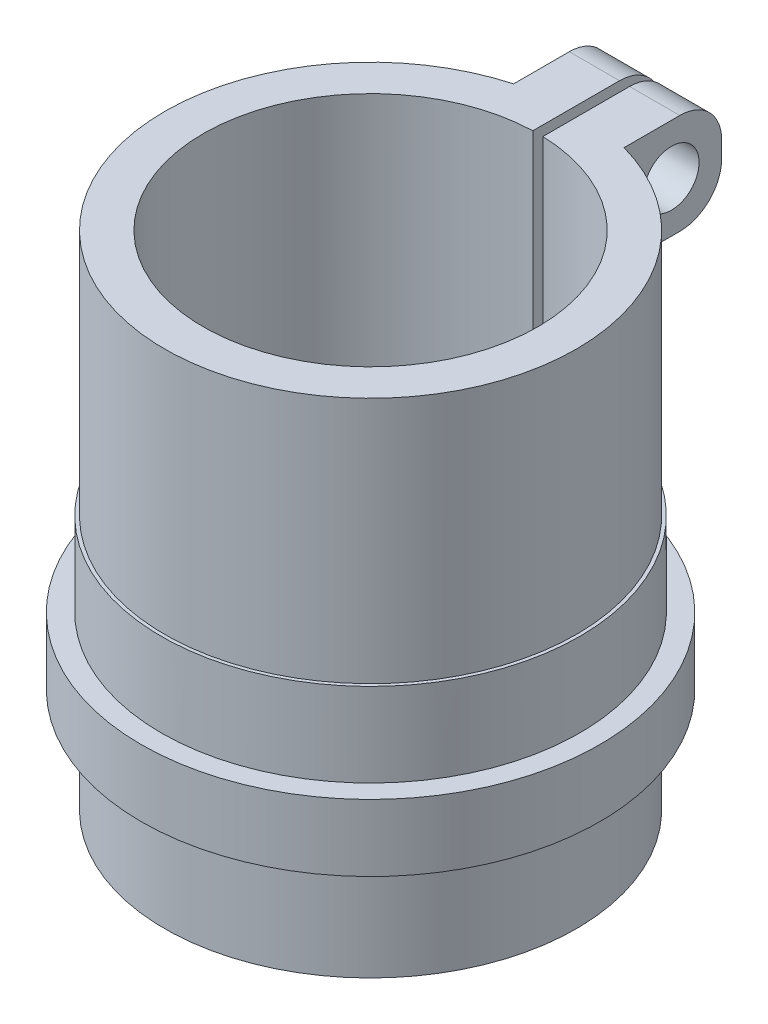
from build123d import *

# Parameters (mm, degrees)
SKETCH1_R           = 15.875
SKETCH1_R_2         = 12.7
BOSS_EXTRUDE1_DEPTH = 38.1
SKETCH2_R           = 17.399
SKETCH2_R_2         = 15.875
BOSS_EXTRUDE2_DEPTH = 5.0673
SKETCH3_R           = 15.875
SKETCH3_R_2         = 15.621
CUT_EXTRUDE1_DEPTH  = 7.9248
CUT_EXTRUDE2_START  = -19.3421
SKETCH3_2_R         = 15.875
SKETCH3_2_R_2       = 15.621
CUT_EXTRUDE2_DEPTH  = 18.7579
SKETCH4_W           = 0.762
SKETCH4_H           = 4.704716286
CUT_EXTRUDE3_DEPTH  = 19.05
SKETCH5_W           = 9.757521138
SKETCH5_H           = 7.62
SKETCH5_R           = 2.1
BOSS_EXTRUDE3_DEPTH = 3.81
FILLET1_R           = 3.175


with BuildPart() as part:
    # Sketch1 → Boss-Extrude1 (new body)
    with BuildSketch(Plane(origin=(0, 0, 0), x_dir=(1, 0, 0), z_dir=(0, 1, 0))):
        with Locations(Location((0, 0, 0), (0, 0, 90))):
            Circle(SKETCH1_R)
        with Locations(Location((0, 0, 0), (0, 0, 90))):
            Circle(SKETCH1_R_2, mode=Mode.SUBTRACT)
    extrude(amount=BOSS_EXTRUDE1_DEPTH)

    # Sketch2 → Boss-Extrude2 (add)
    with BuildSketch(Plane(origin=(0, 7.9248, 0), x_dir=(-1, 0, 0), z_dir=(0, -1, 0))):
        with Locations(Location((0, 0, 0), (0, 0, 90))):
            Circle(SKETCH2_R)
        with Locations(Location((0, 0, 0), (0, 0, 90))):
            Circle(SKETCH2_R_2, mode=Mode.SUBTRACT)
    extrude(amount=-BOSS_EXTRUDE2_DEPTH)

    # Sketch3 → Cut-Extrude1 (cut)
    with BuildSketch(Plane.XZ):
        with Locations(Location((0, 0, 0), (0, 0, 270))):
            Circle(SKETCH3_R)
        with Locations(Location((0, 0, 0), (0, 0, 270))):
            Circle(SKETCH3_R_2, mode=Mode.SUBTRACT)
    extrude(amount=-CUT_EXTRUDE1_DEPTH, mode=Mode.SUBTRACT)

    # Sketch3<2> → Cut-Extrude2 (cut)
    with BuildSketch(Plane.XZ.offset(CUT_EXTRUDE2_START)):
        with Locations(Location((0, 0, 0), (0, 0, 270))):
            Circle(SKETCH3_2_R)
        with Locations(Location((0, 0, 0), (0, 0, 270))):
            Circle(SKETCH3_2_R_2, mode=Mode.SUBTRACT)
    extrude(amount=-CUT_EXTRUDE2_DEPTH, mode=Mode.SUBTRACT)

    # Sketch4 → Cut-Extrude3 (cut)
    with BuildSketch(Plane(origin=(0, 38.1, 0), x_dir=(1, 0, 0), z_dir=(0, 1, 0))):
        with Locations((0, 15.046641857)):
            Rectangle(SKETCH4_W, SKETCH4_H)
    extrude(amount=-CUT_EXTRUDE3_DEPTH, mode=Mode.SUBTRACT)

    # Sketch5 → Boss-Extrude3 (add)
    with BuildSketch(Plane.ZY.offset(-0.381)):
        with Locations((-17.573044283, 34.29)):
            Rectangle(SKETCH5_W, SKETCH5_H)
        with Locations((-18.641804852, 34.29)):
            Circle(SKETCH5_R, mode=Mode.SUBTRACT)
    boss_extrude3 = extrude(amount=-BOSS_EXTRUDE3_DEPTH)

    # Mirror1: Boss-Extrude3 across plane
    add(boss_extrude3.mirror(Plane(origin=(0, 0, 0), x_dir=(0, 0, 1), z_dir=(1, 0, 0))))

    # Fillet1
    fillet1_edges = [part.edges().sort_by_distance(p)[0] for p in [
        (-2.286, 30.48, -22.451804852),
        (2.286, 30.48, -22.451804852),
        (2.286, 38.1, -22.451804852),
        (-2.286, 38.1, -22.451804852),
    ]]
    fillet(fillet1_edges, radius=FILLET1_R)


solid = part.part
